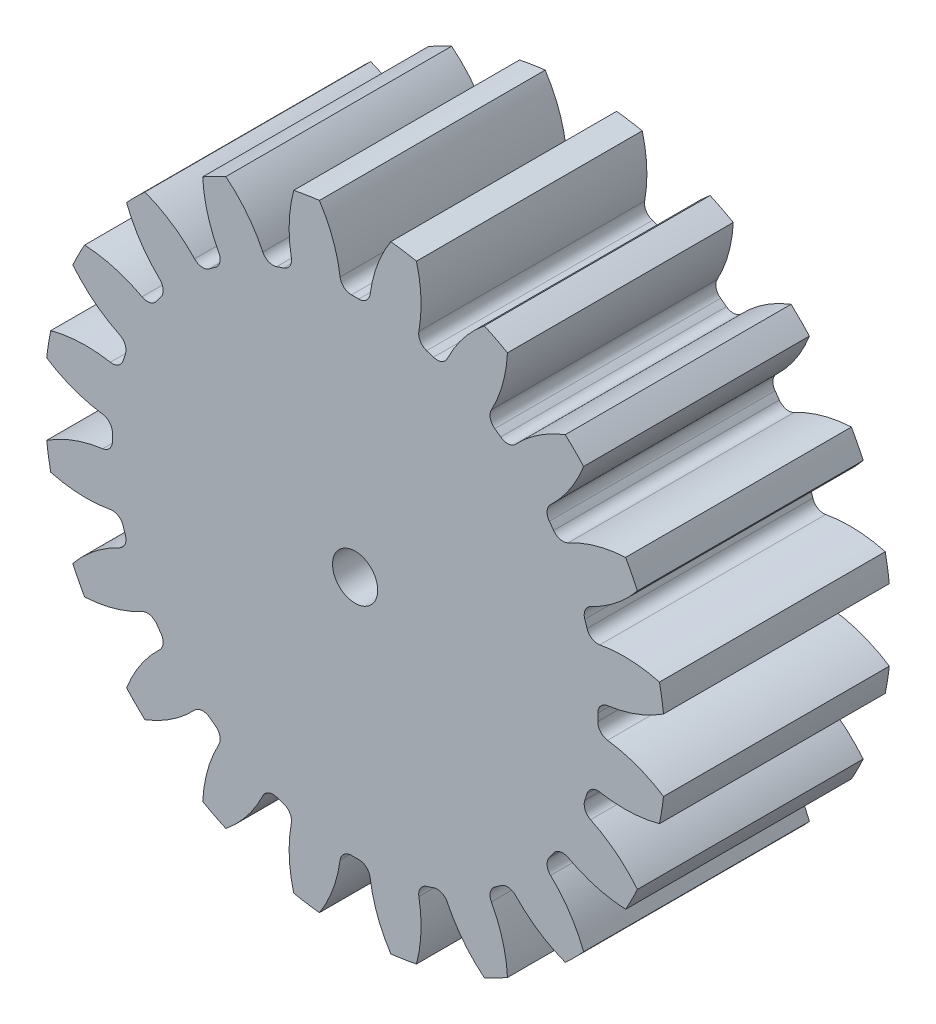
from build123d import *

# Parameters (mm, degrees)
SKETCH1_R                = 34.925
BOSS_EXTRUDE2_DEPTH      = 12.7
CUT_EXTRUDE3_DEPTH       = 56.539816798
FILLET1_R                = 1.27
FILLET2_R                = 1.27
CIRPATTERN2_COUNT        = 20
FILLET1_OF_CIRPATTERN2_R = 1.27
FILLET2_OF_CIRPATTERN2_R = 1.27
CUT_EXTRUDE4_DEPTH       = 51.680770695
CUT_EXTRUDE4_DEPTH_BACK  = 51.680770695
SKETCH1_4_R              = 2.54


with BuildPart() as part:
    # Sketch1 → Boss-Extrude2 (new, symmetric)
    with BuildSketch(Plane.XY):
        Circle(SKETCH1_R)
    extrude(amount=BOSS_EXTRUDE2_DEPTH, both=True)

    # Sketch2 → Cut-Extrude3 (cut, symmetric)
    with BuildSketch(Plane.XY.offset(12.7)):
        with BuildLine():
            ThreePointArc((4.016263699, 34.693302681), (0, 34.925), (-4.016263699, 34.693302681))
            ThreePointArc((-4.016263699, 34.693302681), (-2.311178492, 31.135576921), (-1.575889202, 27.25948639))
            ThreePointArc((-1.575889202, 27.25948639), (0, 27.305), (1.575889202, 27.25948639))
            ThreePointArc((1.575889202, 27.25948639), (2.311178492, 31.135576921), (4.016263699, 34.693302681))
        make_face()
    cut_extrude3 = extrude(amount=CUT_EXTRUDE3_DEPTH, both=True, mode=Mode.SUBTRACT)

    # Fillet1
    fillet1_edges = [part.edges().sort_by_distance(p)[0] for p in [
        (-1.575889202, 27.25948639, 0),
    ]]
    fillet(fillet1_edges, radius=FILLET1_R)

    # Fillet2
    fillet2_edges = [part.edges().sort_by_distance(p)[0] for p in [
        (1.575889202, 27.25948639, 0),
    ]]
    fillet(fillet2_edges, radius=FILLET2_R)

    # CirPattern2: Cut-Extrude3 ×20 about axis
    cirpattern2_axis = Axis((0, 0, 12.7), (0, 0, -1))
    for i in range(1, CIRPATTERN2_COUNT):
        add(cut_extrude3.rotate(cirpattern2_axis, i * 360 / CIRPATTERN2_COUNT), mode=Mode.SUBTRACT)

    # Fillet1 of CirPattern2
    fillet1_of_cirpattern2_edges = [part.edges().sort_by_distance(p)[0] for p in [
        (6.924884857, 26.412288706, 0),
        (14.747802939, 22.97967218, 0),
        (21.127103315, 17.297645231, 0),
        (25.438335617, 9.922404247, 0),
        (27.25948639, 1.575889202, 0),
        (26.412288706, -6.924884857, 0),
        (22.97967218, -14.747802939, 0),
        (17.297645231, -21.127103315, 0),
        (9.922404247, -25.438335617, 0),
        (1.575889202, -27.25948639, 0),
        (-6.924884857, -26.412288706, 0),
        (-14.747802939, -22.97967218, 0),
        (-21.127103315, -17.297645231, 0),
        (-25.438335617, -9.922404247, 0),
        (-27.25948639, -1.575889202, 0),
        (-26.412288706, 6.924884857, 0),
        (-22.97967218, 14.747802939, 0),
        (-17.297645231, 21.127103315, 0),
        (-9.922404247, 25.438335617, 0),
    ]]
    fillet(fillet1_of_cirpattern2_edges, radius=FILLET1_OF_CIRPATTERN2_R)

    # Fillet2 of CirPattern2
    fillet2_of_cirpattern2_edges = [part.edges().sort_by_distance(p)[0] for p in [
        (9.922404247, 25.438335617, 0),
        (17.297645231, 21.127103315, 0),
        (22.97967218, 14.747802939, 0),
        (26.412288706, 6.924884857, 0),
        (27.25948639, -1.575889202, 0),
        (25.438335617, -9.922404247, 0),
        (21.127103315, -17.297645231, 0),
        (14.747802939, -22.97967218, 0),
        (6.924884857, -26.412288706, 0),
        (-1.575889202, -27.25948639, 0),
        (-9.922404247, -25.438335617, 0),
        (-17.297645231, -21.127103315, 0),
        (-22.97967218, -14.747802939, 0),
        (-26.412288706, -6.924884857, 0),
        (-27.25948639, 1.575889202, 0),
        (-25.438335617, 9.922404247, 0),
        (-21.127103315, 17.297645231, 0),
        (-14.747802939, 22.97967218, 0),
        (-6.924884857, 26.412288706, 0),
    ]]
    fillet(fillet2_of_cirpattern2_edges, radius=FILLET2_OF_CIRPATTERN2_R)

    # Sketch1<4> → Cut-Extrude4 (cut, two sides: drawn at the far end of the back side and taken through both)
    with BuildSketch(Plane.XY.offset(-CUT_EXTRUDE4_DEPTH_BACK)):
        Circle(SKETCH1_4_R)
    extrude(amount=CUT_EXTRUDE4_DEPTH + CUT_EXTRUDE4_DEPTH_BACK, mode=Mode.SUBTRACT)


solid = part.part
